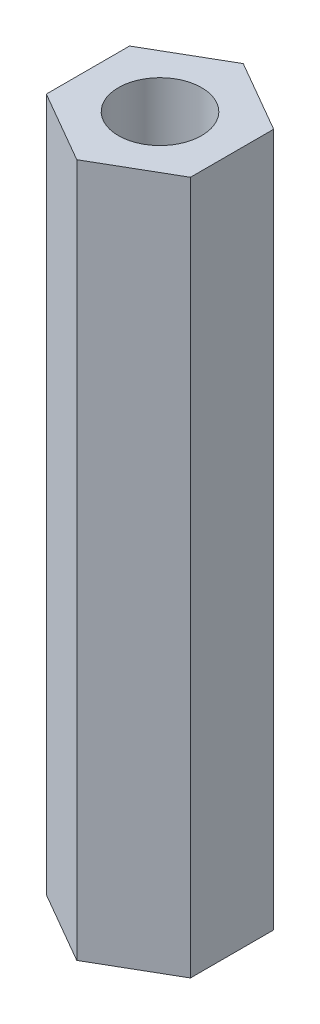
from build123d import *

# Parameters (mm, degrees)
SKETCH1_R           = 1.5
BOSS_EXTRUDE1_DEPTH = 25


with BuildPart() as part:
    # Sketch1 → Boss-Extrude1 (new body)
    with BuildSketch(Plane(origin=(0, 0, 0), x_dir=(1, 0, 0), z_dir=(0, 1, 0))):
        Polygon((0, 3), (-2.598076211, 1.5), (-2.598076211, -1.5), (0, -3), (2.598076211, -1.5), (2.598076211, 1.5), align=None)
        with Locations(Location((0, 0, 0), (0, 0, 270))):
            Circle(SKETCH1_R, mode=Mode.SUBTRACT)
    extrude(amount=BOSS_EXTRUDE1_DEPTH)


solid = part.part
